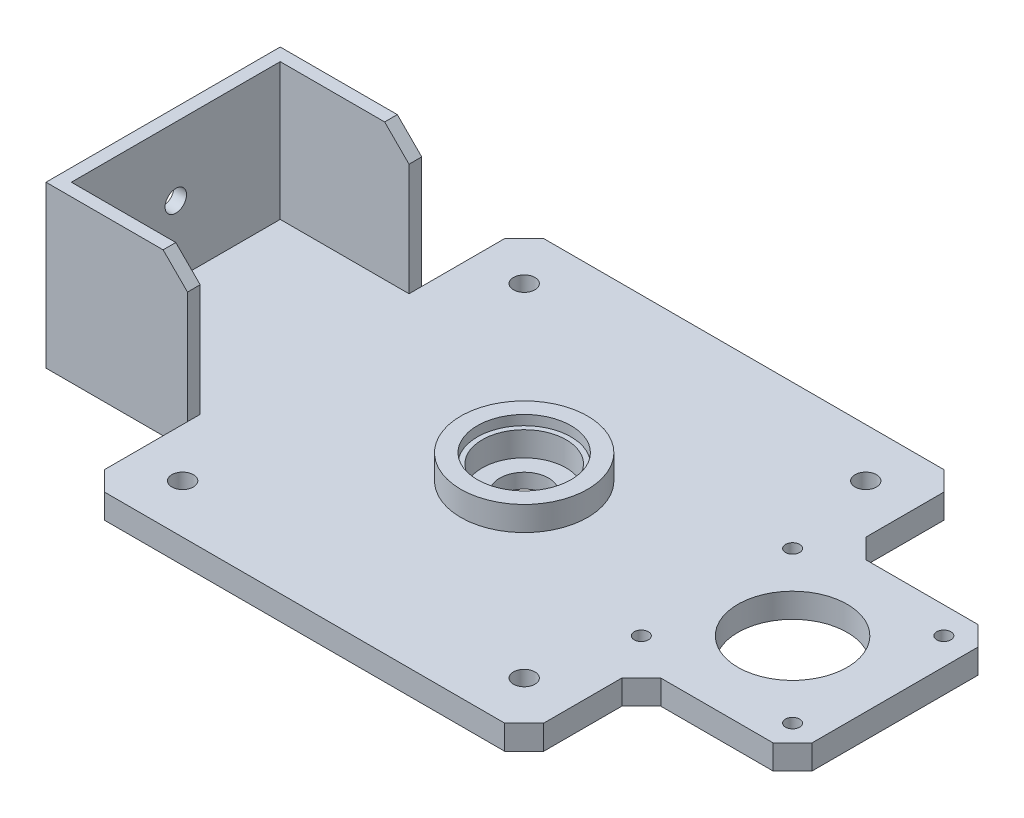
from build123d import *

# Parameters (mm, degrees)
SKETCH1_R           = 2.2
SKETCH1_R_2         = 1.45
SKETCH1_R_3         = 13
SKETCH1_R_4         = 11.2
BOSS_EXTRUDE1_DEPTH = 5
BOSS_EXTRUDE2_DEPTH = 33
SKETCH1_4_R         = 13
SKETCH1_4_R_2       = 5
BOSS_EXTRUDE3_DEPTH = 3
SKETCH1_5_R         = 13
SKETCH1_5_R_2       = 8.6
BOSS_EXTRUDE4_DEPTH = 8
SKETCH1_6_R         = 13
SKETCH1_6_R_2       = 9.6
BOSS_EXTRUDE5_DEPTH = 10
SKETCH2_R           = 2.2
CUT_EXTRUDE1_DEPTH  = 10
CHAMFER1_SIZE       = 4
CHAMFER2_SIZE       = 5


with BuildPart() as part:
    # Sketch1 → Boss-Extrude1 (new body)
    with BuildSketch(Plane(origin=(0, 0, 0), x_dir=(1, 0, 0), z_dir=(0, 1, 0))):
        Polygon((45, 45), (-45, 45), (-45, 24), (-74, 24), (-74, -24), (-45, -24), (-45, -45), (45, -45), (45, -21), (76, -21), (76, 21), (45, 21), align=None)
        with Locations((-35, -35)):
            Circle(SKETCH1_R, mode=Mode.SUBTRACT)
        with Locations((35, -35)):
            Circle(SKETCH1_R, mode=Mode.SUBTRACT)
        with Locations((39.5, -15.5)):
            Circle(SKETCH1_R_2, mode=Mode.SUBTRACT)
        with Locations((70.5, -15.5)):
            Circle(SKETCH1_R_2, mode=Mode.SUBTRACT)
        Circle(SKETCH1_R_3, mode=Mode.SUBTRACT)
        with Locations((-35, 35)):
            Circle(SKETCH1_R, mode=Mode.SUBTRACT)
        with Locations((55, 0)):
            Circle(SKETCH1_R_4, mode=Mode.SUBTRACT)
        with Locations((39.5, 15.5)):
            Circle(SKETCH1_R_2, mode=Mode.SUBTRACT)
        with Locations((70.5, 15.5)):
            Circle(SKETCH1_R_2, mode=Mode.SUBTRACT)
        with Locations((35, 35)):
            Circle(SKETCH1_R, mode=Mode.SUBTRACT)
    extrude(amount=BOSS_EXTRUDE1_DEPTH)

    # Sketch1<3> → Boss-Extrude2 (add)
    with BuildSketch(Plane(origin=(0, 0, 0), x_dir=(1, 0, 0), z_dir=(0, 1, 0))):
        Polygon((-45, 21.4), (-45, 24), (-74, 24), (-74, -24), (-45, -24), (-45, -21.4), (-71.4, -21.4), (-71.4, 21.4), align=None)
    extrude(amount=BOSS_EXTRUDE2_DEPTH)

    # Sketch1<4> → Boss-Extrude3 (add)
    with BuildSketch(Plane(origin=(0, 0, 0), x_dir=(1, 0, 0), z_dir=(0, 1, 0))):
        Circle(SKETCH1_4_R)
        Circle(SKETCH1_4_R_2, mode=Mode.SUBTRACT)
    extrude(amount=BOSS_EXTRUDE3_DEPTH)

    # Sketch1<5> → Boss-Extrude4 (add)
    with BuildSketch(Plane(origin=(0, 0, 0), x_dir=(1, 0, 0), z_dir=(0, 1, 0))):
        Circle(SKETCH1_5_R)
        Circle(SKETCH1_5_R_2, mode=Mode.SUBTRACT)
    extrude(amount=BOSS_EXTRUDE4_DEPTH)

    # Sketch1<6> → Boss-Extrude5 (add)
    with BuildSketch(Plane(origin=(0, 0, 0), x_dir=(1, 0, 0), z_dir=(0, 1, 0))):
        Circle(SKETCH1_6_R)
        Circle(SKETCH1_6_R_2, mode=Mode.SUBTRACT)
    extrude(amount=BOSS_EXTRUDE5_DEPTH)

    # Sketch2 → Cut-Extrude1 (cut)
    with BuildSketch(Plane(origin=(-71.4, 0, 0), x_dir=(0, 0, -1), z_dir=(1, 0, 0))):
        with Locations((0, 19)):
            Circle(SKETCH2_R)
    extrude(amount=-CUT_EXTRUDE1_DEPTH, mode=Mode.SUBTRACT)

    # Chamfer1
    chamfer1_edges = [part.edges().sort_by_distance(p)[0] for p in [
        (-45, 2.5, 45),
        (-45, 2.5, -45),
        (45, 2.5, -45),
        (45, 2.5, -21),
        (76, 2.5, -21),
        (76, 2.5, 21),
        (45, 2.5, 21),
        (45, 2.5, 45),
    ]]
    chamfer(chamfer1_edges, length=CHAMFER1_SIZE)

    # Chamfer2
    chamfer2_edges = [part.edges().sort_by_distance(p)[0] for p in [
        (-45, 33, -22.7),
        (-45, 33, 22.7),
    ]]
    chamfer(chamfer2_edges, length=CHAMFER2_SIZE)


solid = part.part
